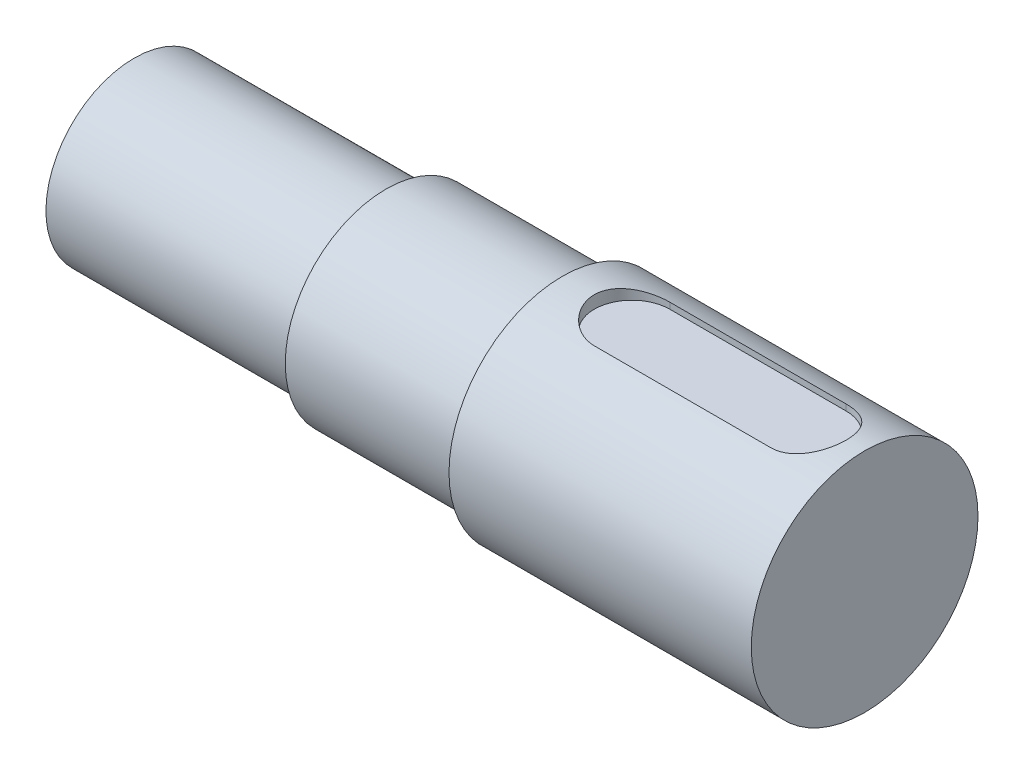
from build123d import *

# Parameters (mm, degrees)
CUT_EXTRUDE1_START = 4
CUT_EXTRUDE1_DEPTH = 10


with BuildPart() as part:
    # Sketch1 → Revolve1 (revolve)
    with BuildSketch(Plane.XY):
        Polygon((0, 0), (0, 3.5), (10, 3.5), (10, 4), (17, 4), (17, 4.5), (29, 4.5), (29, 0), align=None)
    revolve(axis=Axis((29, 0, 0), (-1, 0, 0)))

    # Sketch2 → Cut-Extrude1 (cut)
    with BuildSketch(Plane(origin=(0, 0, 0), x_dir=(1, 0, 0), z_dir=(0, 1, 0)).offset(CUT_EXTRUDE1_START)):
        with BuildLine():
            Line((19.76662124, 1.5), (26.76662124, 1.5))
            ThreePointArc((26.76662124, 1.5), (28.26662124, 0), (26.76662124, -1.5))
            Line((26.76662124, -1.5), (19.76662124, -1.5))
            ThreePointArc((19.76662124, -1.5), (18.26662124, 0), (19.76662124, 1.5))
        make_face()
    extrude(amount=CUT_EXTRUDE1_DEPTH, mode=Mode.SUBTRACT)


solid = part.part
